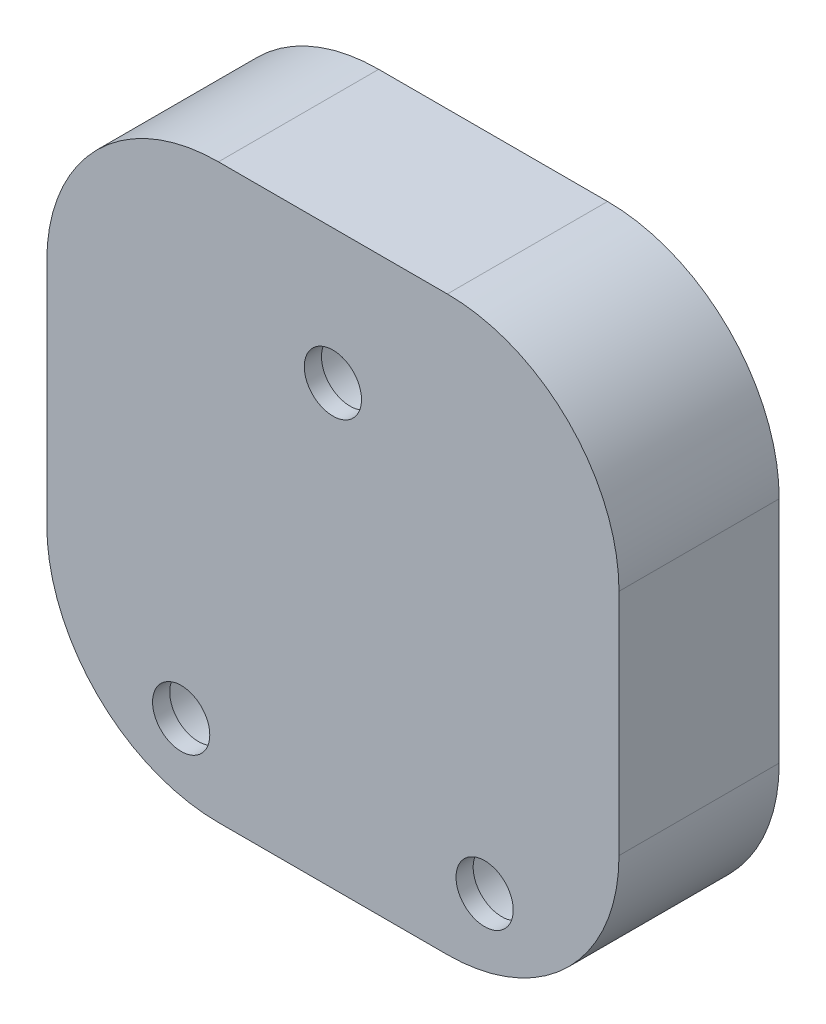
from build123d import *

# Parameters (mm, degrees)
SKETCH1_W           = 100
SKETCH1_H           = 100
SKETCH1_R           = 4.025
SKETCH1_R_2         = 8.1
BOSS_EXTRUDE1_DEPTH = 25
SKETCH2_W           = 100
SKETCH2_H           = 100
SKETCH2_R           = 5
BOSS_EXTRUDE2_DEPTH = 3
FILLET1_R           = 30
FILLET2_R           = 3
SKETCH3_R           = 7.5
CUT_EXTRUDE1_DEPTH  = 25
FILLET3_R           = 3


with BuildPart() as part:
    # Sketch1 → Boss-Extrude1 (new body)
    with BuildSketch(Plane.XY):
        with Locations((0, 37.5)):
            Rectangle(SKETCH1_W, SKETCH1_H)
        Circle(SKETCH1_R, mode=Mode.SUBTRACT)
        with Locations((26.516504294, 64.016504294)):
            Circle(SKETCH1_R, mode=Mode.SUBTRACT)
        with Locations((-26.516504294, 64.016504294)):
            Circle(SKETCH1_R, mode=Mode.SUBTRACT)
        with Locations((0, 64.016504294)):
            Circle(SKETCH1_R_2, mode=Mode.SUBTRACT)
        with Locations((-26.516504294, 0)):
            Circle(SKETCH1_R_2, mode=Mode.SUBTRACT)
        with Locations((26.516504294, 0)):
            Circle(SKETCH1_R_2, mode=Mode.SUBTRACT)
    extrude(amount=-BOSS_EXTRUDE1_DEPTH)

    # Sketch2 → Boss-Extrude2 (add)
    with BuildSketch(Plane.XY):
        with Locations((0, 37.5)):
            Rectangle(SKETCH2_W, SKETCH2_H)
        with Locations((0, 64.016504294)):
            Circle(SKETCH2_R, mode=Mode.SUBTRACT)
        with Locations((26.516504294, 0)):
            Circle(SKETCH2_R, mode=Mode.SUBTRACT)
        with Locations((-26.516504294, 0)):
            Circle(SKETCH2_R, mode=Mode.SUBTRACT)
    extrude(amount=BOSS_EXTRUDE2_DEPTH)

    # Fillet1
    fillet1_edges = [part.edges().sort_by_distance(p)[0] for p in [
        (-50, 87.5, -11),
        (50, 87.5, -11),
        (50, -12.5, -11),
        (-50, -12.5, -11),
    ]]
    fillet(fillet1_edges, radius=FILLET1_R)

    # Fillet2
    fillet2_edges = [part.edges().sort_by_distance(p)[0] for p in [
        (-8.1, 64.016504294, -25),
        (-34.616504294, 0, -25),
        (18.416504295, 0, -25),
    ]]
    fillet(fillet2_edges, radius=FILLET2_R)

    # Sketch3 → Cut-Extrude1 (cut)
    with BuildSketch(Plane(origin=(0, 0, -25), x_dir=(-1, 0, 0), z_dir=(0, 0, -1))):
        with Locations((0, 37.5)):
            Circle(SKETCH3_R)
    extrude(amount=-CUT_EXTRUDE1_DEPTH, mode=Mode.SUBTRACT)

    # Fillet3
    fillet3_edges = [part.edges().sort_by_distance(p)[0] for p in [
        (7.5, 37.5, -25),
    ]]
    fillet(fillet3_edges, radius=FILLET3_R)


solid = part.part
